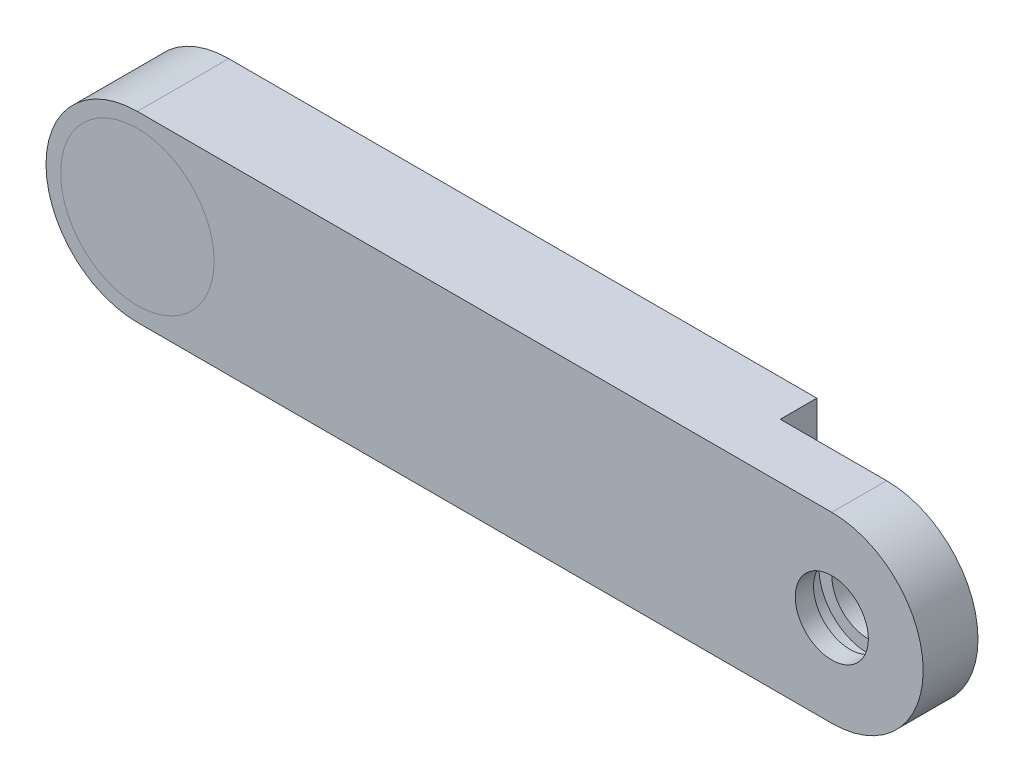
from build123d import *

# Parameters (mm, degrees)
BOSS_EXTRUDE1_DEPTH = 25
SKETCH2_R           = 13.5
CUT_EXTRUDE1_DEPTH  = 25
SKETCH3_R           = 21
CUT_EXTRUDE2_DEPTH  = 25
SKETCH4_R           = 13.5
SKETCH4_R_2         = 10
BOSS_EXTRUDE2_DEPTH = 5
BOSS_EXTRUDE3_START = -15
SKETCH5_R           = 13.5
SKETCH5_R_2         = 10
BOSS_EXTRUDE3_DEPTH = 15
CUT_EXTRUDE3_DEPTH  = 10
SKETCH7_R           = 21
BOSS_EXTRUDE4_DEPTH = 3


with BuildPart() as part:
    # Sketch1 → Boss-Extrude1 (new body)
    with BuildSketch(Plane.XY):
        with BuildLine():
            Line((-154.944852941, 25), (35.055147059, 25))
            ThreePointArc((35.055147059, 25), (60.055147059, 0), (35.055147059, -25))
            Line((35.055147059, -25), (-154.944852941, -25))
            ThreePointArc((-154.944852941, -25), (-179.944852941, 0), (-154.944852941, 25))
        make_face()
    extrude(amount=BOSS_EXTRUDE1_DEPTH)

    # Sketch2 → Cut-Extrude1 (cut)
    with BuildSketch(Plane.XY.offset(25)):
        with Locations((35.055147059, 0)):
            Circle(SKETCH2_R)
    extrude(amount=-CUT_EXTRUDE1_DEPTH, mode=Mode.SUBTRACT)

    # Sketch3 → Cut-Extrude2 (cut)
    with BuildSketch(Plane.XY.offset(25)):
        with Locations((-154.944852941, 0)):
            Circle(SKETCH3_R)
    extrude(amount=-CUT_EXTRUDE2_DEPTH, mode=Mode.SUBTRACT)

    # Sketch4 → Boss-Extrude2 (add)
    with BuildSketch(Plane.XY.offset(25)):
        with Locations((35.055147059, 0)):
            Circle(SKETCH4_R)
        with Locations((35.055147059, 0)):
            Circle(SKETCH4_R_2, mode=Mode.SUBTRACT)
    extrude(amount=-BOSS_EXTRUDE2_DEPTH)

    # Sketch5 → Boss-Extrude3 (add)
    with BuildSketch(Plane(origin=(0, 0, 0), x_dir=(-1, 0, 0), z_dir=(0, 0, -1)).offset(BOSS_EXTRUDE3_START)):
        with Locations(Location((-35.055147059, 0, 0), (0, 0, 180))):
            Circle(SKETCH5_R)
        with Locations(Location((-35.055147059, 0, 0), (0, 0, 180))):
            Circle(SKETCH5_R_2, mode=Mode.SUBTRACT)
    extrude(amount=BOSS_EXTRUDE3_DEPTH)

    # Sketch6 → Cut-Extrude3 (cut)
    with BuildSketch(Plane(origin=(0, 0, 0), x_dir=(-1, 0, 0), z_dir=(0, 0, -1))):
        with BuildLine():
            Line((-35.055147059, 25), (-5.957161701, 25))
            Line((-5.957161701, 25), (-5.957161701, -25))
            Line((-5.957161701, -25), (-35.055147059, -25))
            ThreePointArc((-35.055147059, -25), (-60.055147059, 0), (-35.055147059, 25))
        make_face()
    extrude(amount=-CUT_EXTRUDE3_DEPTH, mode=Mode.SUBTRACT)


with BuildPart() as body_2:
    # Sketch7 → Boss-Extrude4 (new body)
    with BuildSketch(Plane.XY.offset(25)):
        with Locations((-154.944852941, 0)):
            Circle(SKETCH7_R)
    extrude(amount=-BOSS_EXTRUDE4_DEPTH)


solid = Compound([part.part, body_2.part])
